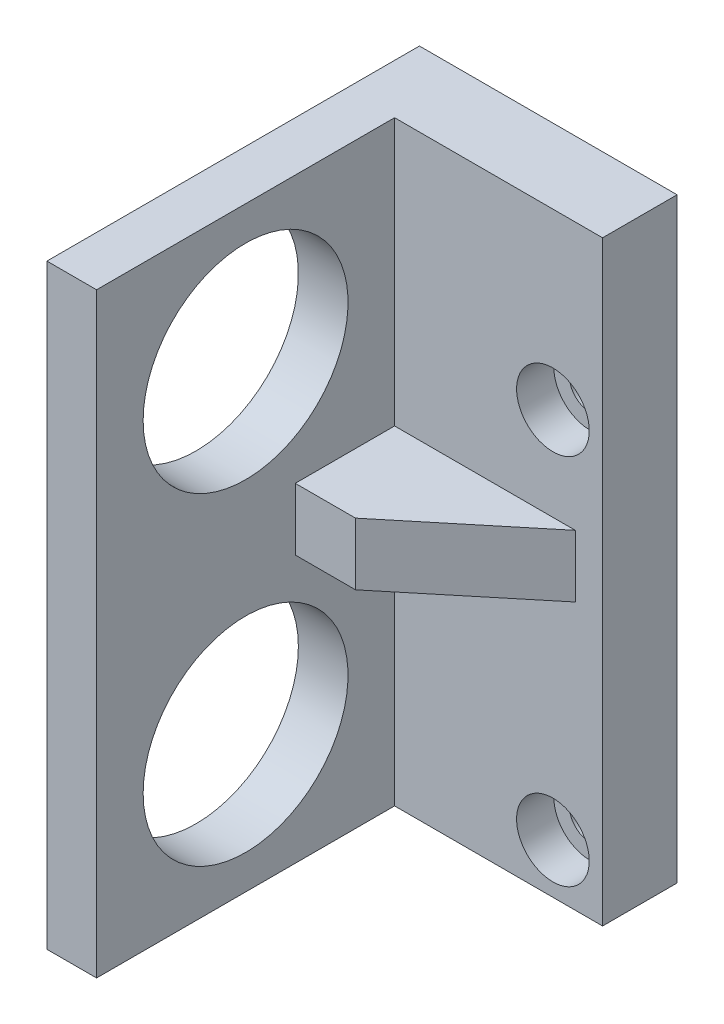
from build123d import *

# Parameters (mm, degrees)
SKETCH1_W           = 20.75
SKETCH1_H           = 48
SKETCH1_R           = 1.675
BOSS_EXTRUDE1_DEPTH = 6
SKETCH2_W           = 30
SKETCH2_H           = 48
BOSS_EXTRUDE2_DEPTH = 4
SKETCH3_R           = 8.25
CUT_EXTRUDE1_DEPTH  = 6
BOSS_EXTRUDE3_START = -26.5
BOSS_EXTRUDE3_DEPTH = 5
SKETCH5_R           = 2.925
CUT_EXTRUDE2_DEPTH  = 3
SKETCH6_W           = 4
SKETCH6_H           = 5
CUT_EXTRUDE3_DEPTH  = 34


with BuildPart() as part:
    # Sketch1 → Boss-Extrude1 (new body)
    with BuildSketch(Plane.XY):
        with Locations((10.375, 24)):
            Rectangle(SKETCH1_W, SKETCH1_H)
        with Locations((16.75, 34)):
            Circle(SKETCH1_R, mode=Mode.SUBTRACT)
        with Locations((16.75, 4)):
            Circle(SKETCH1_R, mode=Mode.SUBTRACT)
    extrude(amount=BOSS_EXTRUDE1_DEPTH)

    # Sketch2 → Boss-Extrude2 (add)
    with BuildSketch(Plane.ZY):
        with Locations((15, 24)):
            Rectangle(SKETCH2_W, SKETCH2_H)
    extrude(amount=-BOSS_EXTRUDE2_DEPTH)

    # Sketch3 → Cut-Extrude1 (cut)
    with BuildSketch(Plane.ZY):
        with Locations((18, 37)):
            Circle(SKETCH3_R)
        with Locations((18, 11)):
            Circle(SKETCH3_R)
    extrude(amount=-CUT_EXTRUDE1_DEPTH, mode=Mode.SUBTRACT)

    # Sketch4 → Boss-Extrude3 (add)
    with BuildSketch(Plane(origin=(0, 48, 0), x_dir=(1, 0, 0), z_dir=(0, 1, 0)).offset(BOSS_EXTRUDE3_START)):
        Polygon((4, -18), (4, -6), (18.555883802, -6), align=None)
    extrude(amount=BOSS_EXTRUDE3_DEPTH)

    # Sketch5 → Cut-Extrude2 (cut)
    with BuildSketch(Plane.XY.offset(6)):
        with Locations((16.75, 34)):
            Circle(SKETCH5_R)
        with Locations((16.75, 4)):
            Circle(SKETCH5_R)
    extrude(amount=-CUT_EXTRUDE2_DEPTH, mode=Mode.SUBTRACT)

    # Sketch6 → Cut-Extrude3 (cut)
    with BuildSketch(Plane(origin=(4, 0, 0), x_dir=(0, 0, -1), z_dir=(1, 0, 0))):
        with Locations((-16, 24)):
            Rectangle(SKETCH6_W, SKETCH6_H)
    extrude(amount=CUT_EXTRUDE3_DEPTH, mode=Mode.SUBTRACT)


solid = part.part
